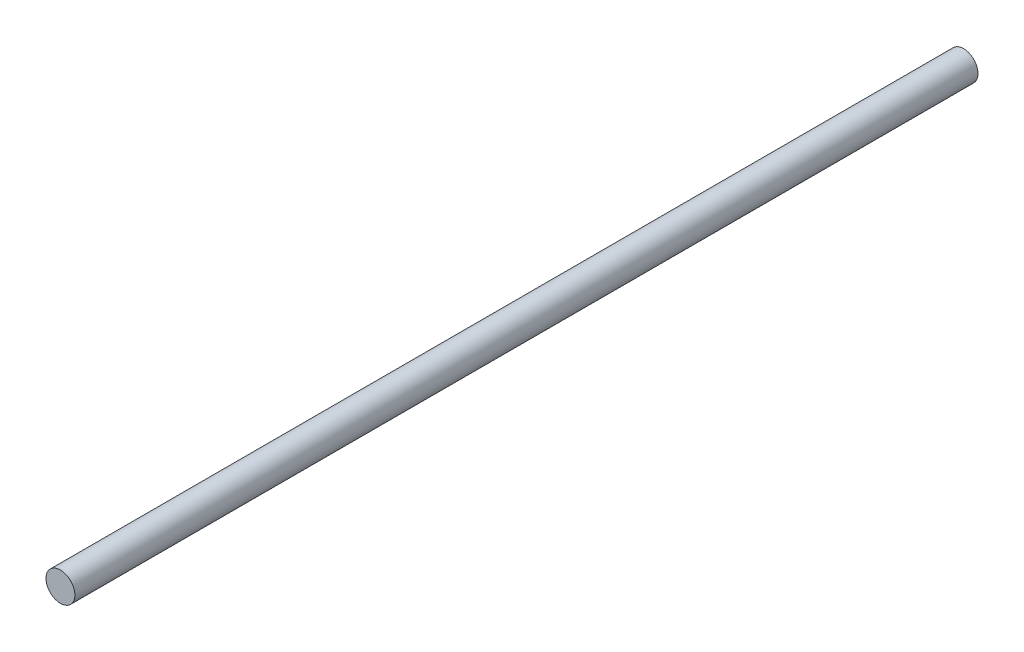
from build123d import *

# Parameters (mm, degrees)
SKETCH1_R           = 10.16
BOSS_EXTRUDE1_DEPTH = 635


with BuildPart() as part:
    # Sketch1 → Boss-Extrude1 (new body)
    with BuildSketch(Plane.XY):
        Circle(SKETCH1_R)
    extrude(amount=-BOSS_EXTRUDE1_DEPTH)


solid = part.part
